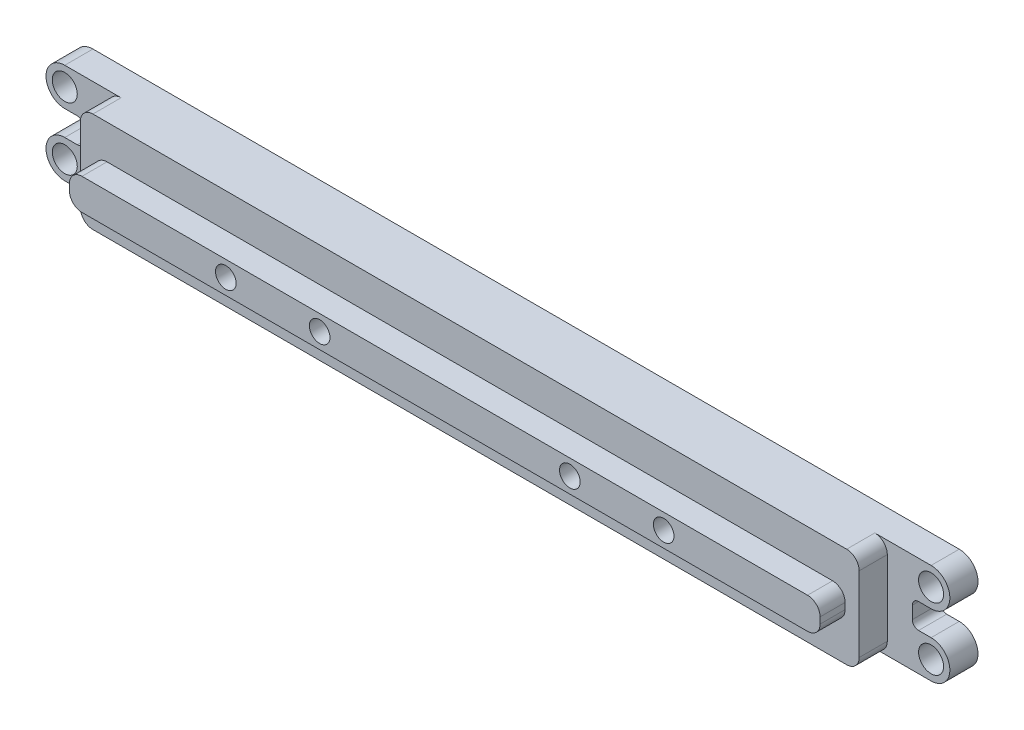
from build123d import *

# Parameters (mm, degrees)
SKETCH_1_R               = 2
EXTRUDE_1_DEPTH          = 4.5
FILLET_1_R               = 1
SKETCH_5_W               = 124.5
SKETCH_5_H               = 16
EXTRUDE_2_DEPTH          = 4.5
SKETCH_6_W               = 120
SKETCH_6_H               = 5
EXTRUDE_3_DEPTH          = 4
CUT_EXTRUDE_1_DEPTH      = 74.186832832
CUT_EXTRUDE_1_DEPTH_BACK = 74.186832832
SKETCH_2_R               = 1.65
FILLET_3_R               = 2


with BuildPart() as part:
    # 草图1 → 凸台-拉伸1 (new body)
    with BuildSketch(Plane.XY):
        with BuildLine():
            ThreePointArc((-69.25, 8), (-72.25, 5), (-69.25, 2))
            Line((-69.25, 2), (-66.25, 2))
            Line((-66.25, 2), (-66.25, -2))
            Line((-66.25, -2), (-69.25, -2))
            ThreePointArc((-69.25, -2), (-72.25, -5), (-69.25, -8))
            Line((-69.25, -8), (69.25, -8))
            ThreePointArc((69.25, -8), (72.25, -5), (69.25, -2))
            Line((69.25, -2), (66.25, -2))
            Line((66.25, -2), (66.25, 2))
            Line((66.25, 2), (69.25, 2))
            ThreePointArc((69.25, 2), (72.25, 5), (69.25, 8))
            Line((69.25, 8), (-69.25, 8))
        make_face()
        with Locations((-69.25, 5)):
            Circle(SKETCH_1_R, mode=Mode.SUBTRACT)
        with Locations((69.25, 5)):
            Circle(SKETCH_1_R, mode=Mode.SUBTRACT)
        with Locations((69.25, -5)):
            Circle(SKETCH_1_R, mode=Mode.SUBTRACT)
        with Locations((-69.25, -5)):
            Circle(SKETCH_1_R, mode=Mode.SUBTRACT)
    extrude(amount=EXTRUDE_1_DEPTH)

    # 圆角1
    fillet_1_edges = [part.edges().sort_by_distance(p)[0] for p in [
        (-66.25, -2, 2.25),
        (-66.25, 2, 2.25),
        (66.25, 2, 2.25),
        (66.25, -2, 2.25),
    ]]
    fillet(fillet_1_edges, radius=FILLET_1_R)

    # 草图5 → 凸台-拉伸2 (add)
    with BuildSketch(Plane.XY.offset(4.5)):
        Rectangle(SKETCH_5_W, SKETCH_5_H)
    extrude(amount=EXTRUDE_2_DEPTH)

    # 草图6 → 凸台-拉伸3 (add)
    with BuildSketch(Plane.XY.offset(9)):
        Rectangle(SKETCH_6_W, SKETCH_6_H)
    extrude(amount=EXTRUDE_3_DEPTH)

    # 草图2 → 切除-拉伸1 (cut, two sides: drawn at the far end of the back side and taken through both)
    with BuildSketch(Plane.XY.offset(4.5).offset(-CUT_EXTRUDE_1_DEPTH_BACK)):
        with Locations((35, 0)):
            Circle(SKETCH_2_R)
        with Locations((20, 0)):
            Circle(SKETCH_2_R)
        with Locations((-20, 0)):
            Circle(SKETCH_2_R)
        with Locations((-35, 0)):
            Circle(SKETCH_2_R)
    extrude(amount=CUT_EXTRUDE_1_DEPTH + CUT_EXTRUDE_1_DEPTH_BACK, mode=Mode.SUBTRACT)

    # 圆角3
    fillet_3_edges = [part.edges().sort_by_distance(p)[0] for p in [
        (-62.25, 8, 6.75),
        (62.25, 8, 6.75),
        (62.25, -8, 6.75),
        (-62.25, -8, 6.75),
        (-60, -2.5, 11),
        (60, -2.5, 11),
        (60, 2.5, 11),
        (-60, 2.5, 11),
    ]]
    fillet(fillet_3_edges, radius=FILLET_3_R)


solid = part.part
